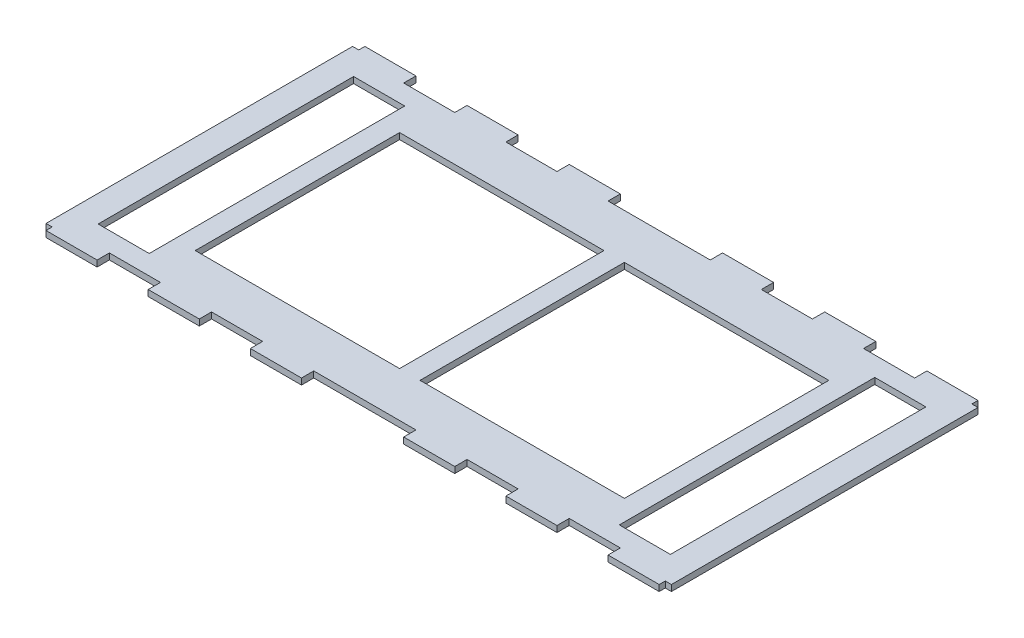
from build123d import *

# Parameters (mm, degrees)
EXTRUDE_1_DEPTH = 6


with BuildPart() as part:
    # 草图1 → 凸台-拉伸1 (new body)
    with BuildSketch(Plane(origin=(0, 0, 0), x_dir=(1, 0, 0), z_dir=(0, 1, 0))):
        Polygon((30, 300), (24, 300), (24, 0), (30, 0), (30, -6), (80, -6), (80, 6), (130, 6), (130, -6), (180, -6), (180, 6), (230, 6), (230, -6), (280, -6), (280, 6), (380, 6), (380, -6), (430, -6), (430, 6), (480, 6), (480, -6), (530, -6), (530, 6), (580, 6), (580, -6), (630, -6), (630, 0), (636, 0), (636, 300), (630, 300), (630, 306), (580, 306), (580, 294), (530, 294), (530, 306), (480, 306), (480, 294), (430, 294), (430, 306), (380, 306), (380, 294), (280, 294), (280, 306), (230, 306), (230, 294), (180, 294), (180, 306), (130, 306), (130, 294), (80, 294), (80, 306), (30, 306), align=None)
        Polygon((340, 150), (340, 250), (540, 250), (540, 50), (340, 50), align=None, mode=Mode.SUBTRACT)
        Polygon((560, 150), (560, 275), (610, 275), (610, 25), (560, 25), align=None, mode=Mode.SUBTRACT)
        Polygon((100, 25), (100, 150), (100, 275), (50, 275), (50, 25), align=None, mode=Mode.SUBTRACT)
        Polygon((320, 50), (320, 150), (320, 250), (120, 250), (120, 50), align=None, mode=Mode.SUBTRACT)
    extrude(amount=EXTRUDE_1_DEPTH)


solid = part.part
